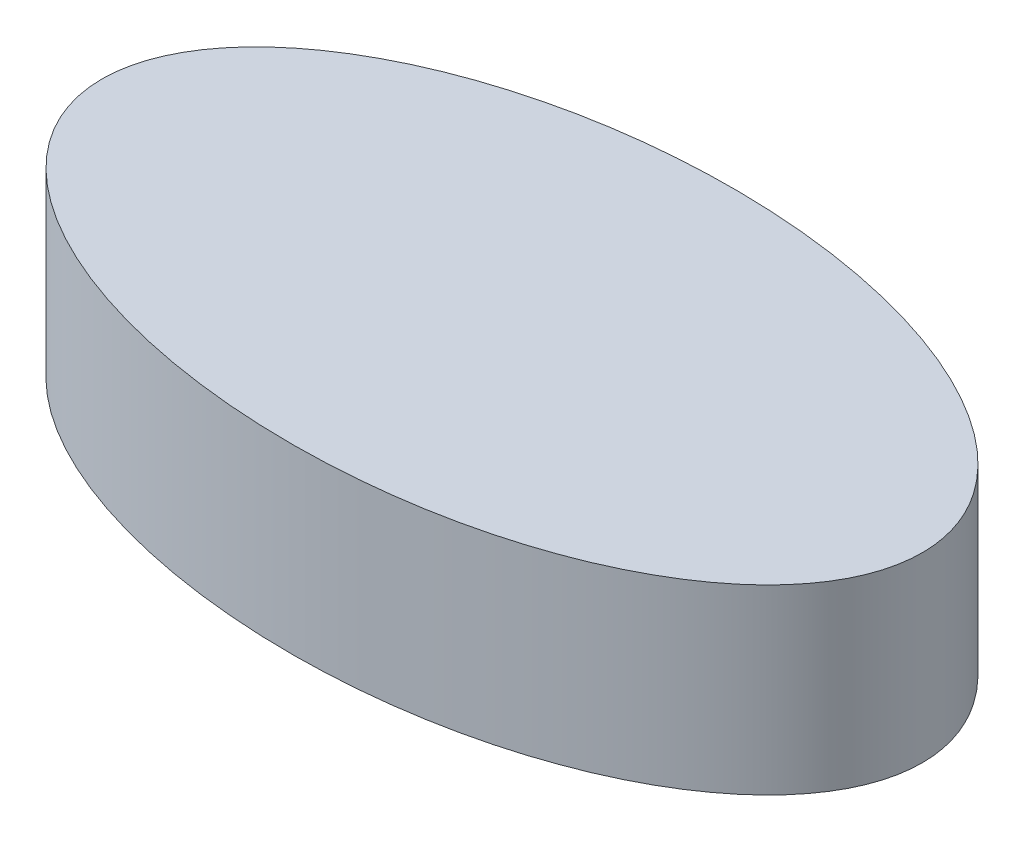
from build123d import *

# Parameters (mm, degrees)
SKETCH1_RX          = 338.178695974
SKETCH1_RY          = 182.259434312
BOSS_EXTRUDE1_DEPTH = 150


with BuildPart() as part:
    # Sketch1 → Boss-Extrude1 (new body)
    with BuildSketch(Plane(origin=(0, 0, 0), x_dir=(1, 0, 0), z_dir=(0, 1, 0))):
        with Locations(Location((0, 0), (0, 0, 180))):
            Ellipse(SKETCH1_RX, SKETCH1_RY)
    extrude(amount=BOSS_EXTRUDE1_DEPTH)

    # Sketch3 → Cut-Revolve2 (revolve, cut)
    with BuildSketch(Plane(origin=(162.6, 0, 0), x_dir=(0, 0, -1), z_dir=(1, 0, 0))):
        with BuildLine():
            Line((0, 0), (0, 60))
            ThreePointArc((0, 60), (42.426406871, 42.426406871), (60, 0))
            Line((60, 0), (0, 0))
        make_face()
    revolve(axis=Axis((162.6, 0, 0), (0, 1, 0)), mode=Mode.SUBTRACT)

    # Sketch5 → Cut-Revolve3 (revolve, cut)
    with BuildSketch(Plane(origin=(-162.6, 0, 0), x_dir=(0, 0, -1), z_dir=(1, 0, 0))):
        with BuildLine():
            Line((0, 0), (0, 60))
            ThreePointArc((0, 60), (42.426406871, 42.426406871), (60, 0))
            Line((60, 0), (0, 0))
        make_face()
    revolve(axis=Axis((-162.6, 0, 0), (0, 1, 0)), mode=Mode.SUBTRACT)


solid = part.part
